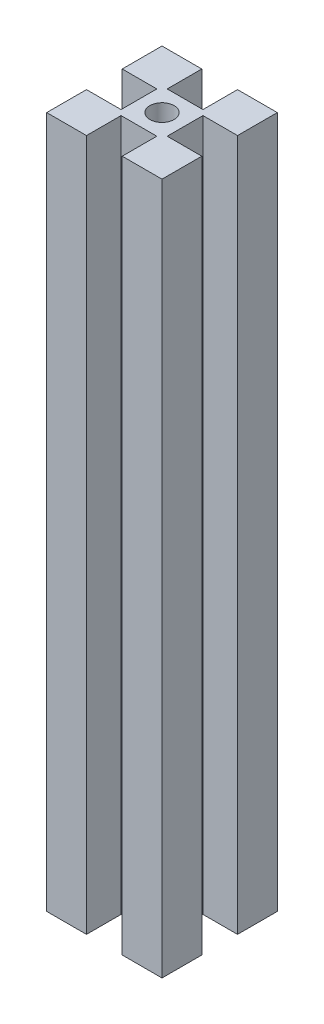
from build123d import *

# Parameters (mm, degrees)
SK_PROFILE_R    = 2.1
EXTRUSION_DEPTH = 120


with BuildPart() as part:
    # SK_Profile → Extrusion (new body)
    with BuildSketch(Plane(origin=(0, 0, 0), x_dir=(1, 0, 0), z_dir=(0, 1, 0))):
        Polygon((10, -10), (10, -3.1), (4, -3.1), (4, 3.1), (10, 3.1), (10, 10), (3.1, 10), (3.1, 4), (-3.1, 4), (-3.1, 10), (-10, 10), (-10, 3.1), (-4, 3.1), (-4, -3.1), (-10, -3.1), (-10, -10), (-3.1, -10), (-3.1, -4), (3.1, -4), (3.1, -10), align=None)
        with Locations(Location((0, 0, 0), (0, 0, 270))):
            Circle(SK_PROFILE_R, mode=Mode.SUBTRACT)
    extrude(amount=EXTRUSION_DEPTH)


solid = part.part
